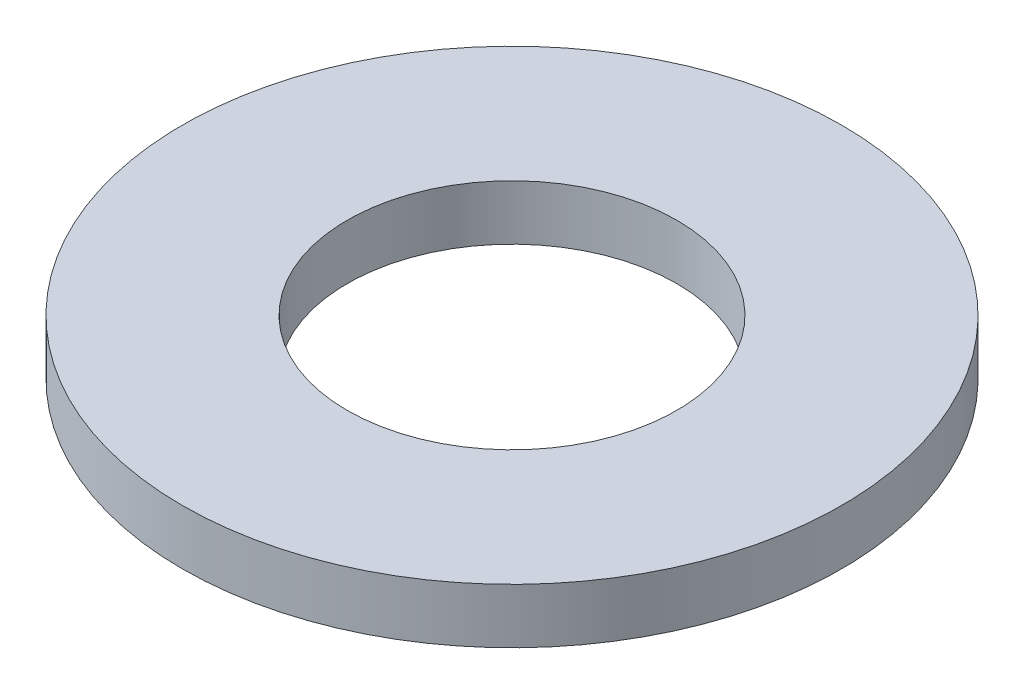
from build123d import *

# Parameters (mm, degrees)
SKETCH1_R           = 3
SKETCH1_R_2         = 1.5
BOSS_EXTRUDE1_DEPTH = 0.5


with BuildPart() as part:
    # Sketch1 → Boss-Extrude1 (new body)
    with BuildSketch(Plane(origin=(0, 0, 0), x_dir=(1, 0, 0), z_dir=(0, 1, 0))):
        with Locations(Location((0, 0, 0), (0, 0, 270))):
            Circle(SKETCH1_R)
        with Locations(Location((0, 0, 0), (0, 0, 270))):
            Circle(SKETCH1_R_2, mode=Mode.SUBTRACT)
    extrude(amount=BOSS_EXTRUDE1_DEPTH)


solid = part.part
